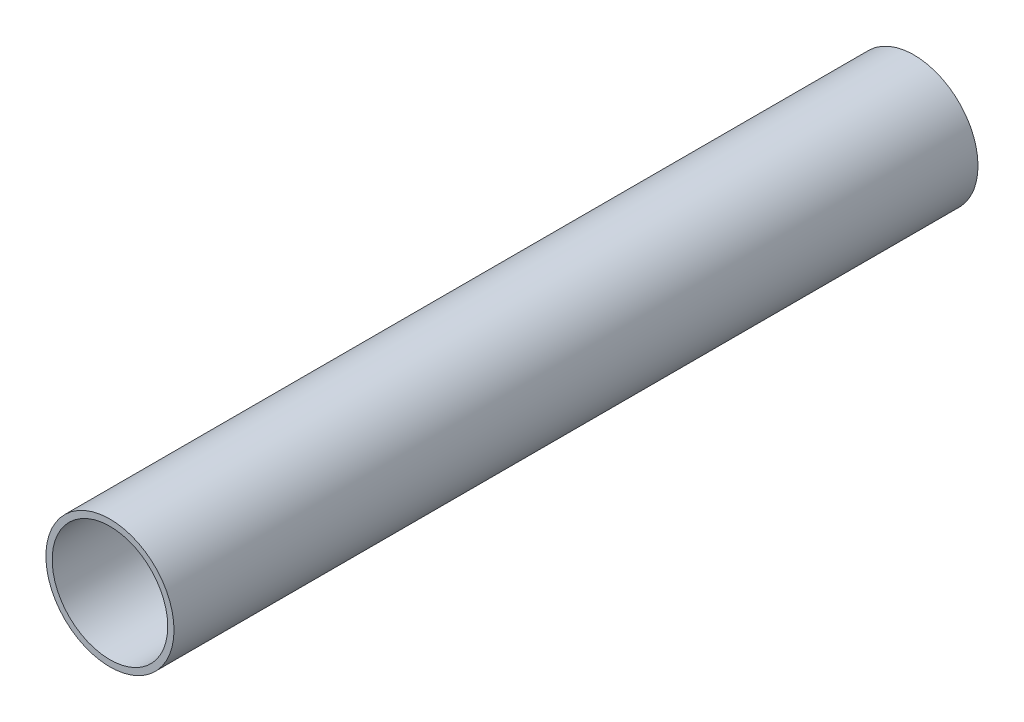
from build123d import *

# Parameters (mm, degrees)
SKETCH1_R           = 12.75
SKETCH1_R_2         = 11.5
BOSS_EXTRUDE1_DEPTH = 160


with BuildPart() as part:
    # Sketch1 → Boss-Extrude1 (new body)
    with BuildSketch(Plane.XY):
        Circle(SKETCH1_R)
        Circle(SKETCH1_R_2, mode=Mode.SUBTRACT)
    extrude(amount=BOSS_EXTRUDE1_DEPTH)


solid = part.part
